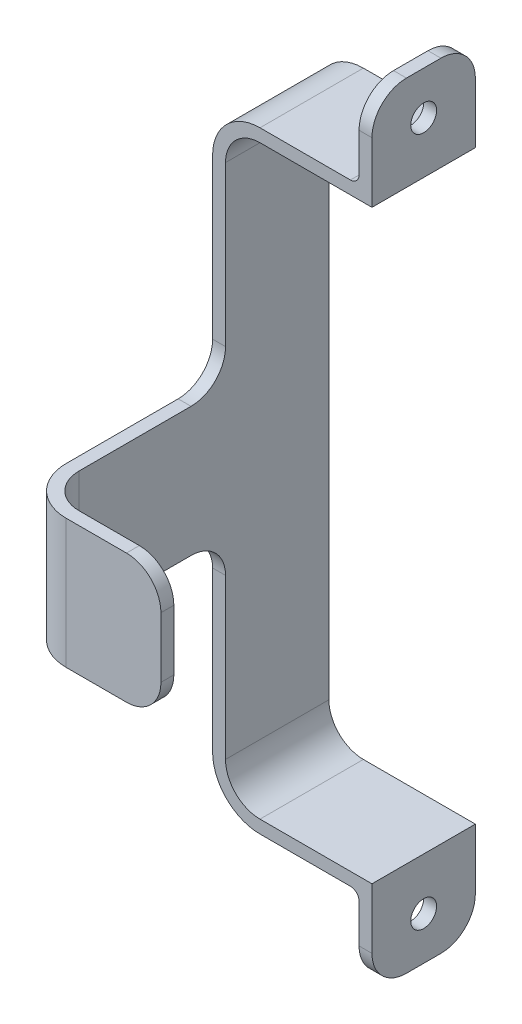
from build123d import *

# Parameters (mm, degrees)
EXTRU_MINCE1_DEPTH      = 6
EXTRU_MINCE2_DEPTH      = 7.5
CONG_1_R                = 4
CONG_2_R                = 1
ESQUISSE3_R             = 1.5
ENL_V_MAT_EXTRU_1_DEPTH = 57.387055252


with BuildPart() as part:
    # Esquisse1 → Extru.-Mince1 (new, symmetric)
    with BuildSketch(Plane.XY):
        with BuildLine():
            Line((0, -45), (0, -34))
            Line((0, -34), (-13, -34))
            ThreePointArc((-13, -34), (-15.828427125, -32.828427125), (-17, -30))
            Line((-17, -30), (-17, 30))
            ThreePointArc((-17, 30), (-15.828427125, 32.828427125), (-13, 34))
            Line((-13, 34), (0, 34))
            Line((0, 34), (0, 45))
            Line((0, 45), (-1.5, 45))
            Line((-1.5, 45), (-1.5, 35.5))
            Line((-1.5, 35.5), (-13, 35.5))
            ThreePointArc((-13, 35.5), (-16.889087297, 33.889087297), (-18.5, 30))
            Line((-18.5, 30), (-18.5, -30))
            ThreePointArc((-18.5, -30), (-16.889087297, -33.889087297), (-13, -35.5))
            Line((-13, -35.5), (-1.5, -35.5))
            Line((-1.5, -35.5), (-1.5, -45))
            Line((-1.5, -45), (0, -45))
        make_face()
    extrude(amount=EXTRU_MINCE1_DEPTH, both=True)

    # Esquisse2 → Extru.-Mince2 (add, symmetric)
    with BuildSketch(Plane(origin=(0, 0, 0), x_dir=(1, 0, 0), z_dir=(0, 1, 0))):
        with BuildLine():
            Line((-17, -6), (-17, -23))
            ThreePointArc((-17, -23), (-15.828427125, -25.828427125), (-13, -27))
            Line((-13, -27), (-2, -27))
            Line((-2, -27), (-2, -28.5))
            Line((-2, -28.5), (-13, -28.5))
            ThreePointArc((-13, -28.5), (-16.889087297, -26.889087297), (-18.5, -23))
            Line((-18.5, -23), (-18.5, -6))
            Line((-18.5, -6), (-17, -6))
        make_face()
    extrude(amount=EXTRU_MINCE2_DEPTH, both=True)

    # Congé1
    cong_1_edges = [part.edges().sort_by_distance(p)[0] for p in [
        (-0.75, 45, -6),
        (-0.75, 45, 6),
        (-2, 7.5, 27.75),
        (-2, -7.5, 27.75),
        (-0.75, -45, -6),
        (-0.75, -45, 6),
        (-17.75, -7.5, 6),
        (-17.75, 7.5, 6),
    ]]
    fillet(cong_1_edges, radius=CONG_1_R)

    # Congé2
    cong_2_edges = [part.edges().sort_by_distance(p)[0] for p in [
        (-1.5, -35.5, 0),
        (-1.5, 35.5, 0),
    ]]
    fillet(cong_2_edges, radius=CONG_2_R)

    # Esquisse3 → Enlèv. mat.-Extru.1 (cut, through all)
    with BuildSketch(Plane(origin=(0, 0, 0), x_dir=(0, 0, -1), z_dir=(1, 0, 0))):
        with Locations(Location((0, 40, 0), (0, 0, 90))):
            Circle(ESQUISSE3_R)
        with Locations(Location((0, -40, 0), (0, 0, 90))):
            Circle(ESQUISSE3_R)
    extrude(amount=-ENL_V_MAT_EXTRU_1_DEPTH, mode=Mode.SUBTRACT)


solid = part.part
